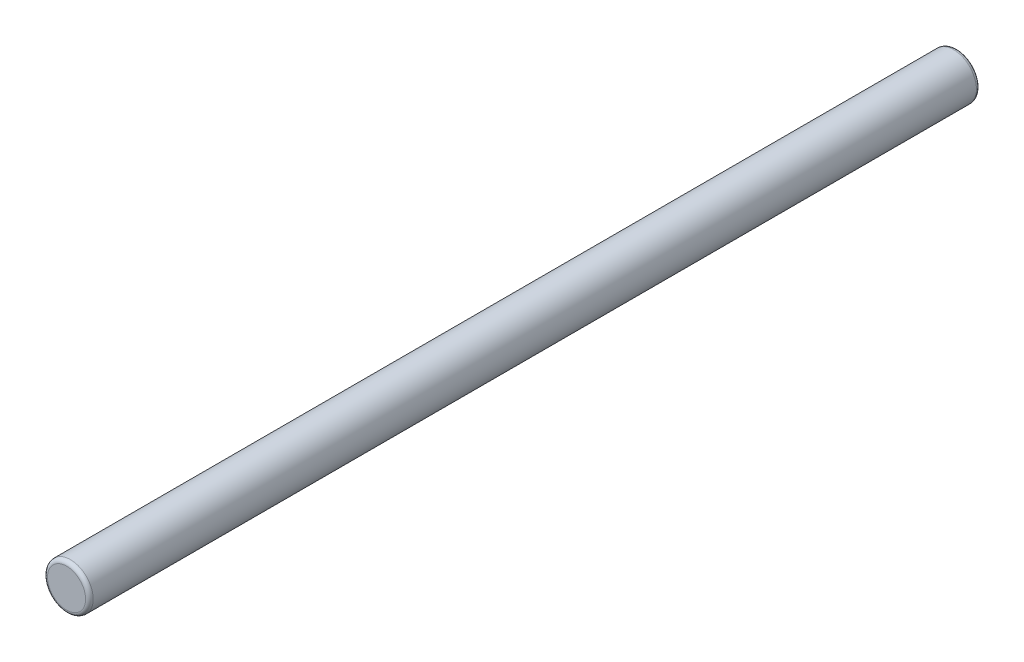
from build123d import *

# Parameters (mm, degrees)
ESBO_O1_R                = 3
RESSALTO_EXTRUS_O1_DEPTH = 117
FILETE1_R                = 0.5


with BuildPart() as part:
    # Esboço1 → Ressalto-extrusão1 (new body)
    with BuildSketch(Plane.XY):
        Circle(ESBO_O1_R)
    extrude(amount=RESSALTO_EXTRUS_O1_DEPTH)

    # Filete1
    filete1_edges = [part.edges().sort_by_distance(p)[0] for p in [
        (-3, 0, 0),
        (-3, 0, 117),
    ]]
    fillet(filete1_edges, radius=FILETE1_R)


solid = part.part
